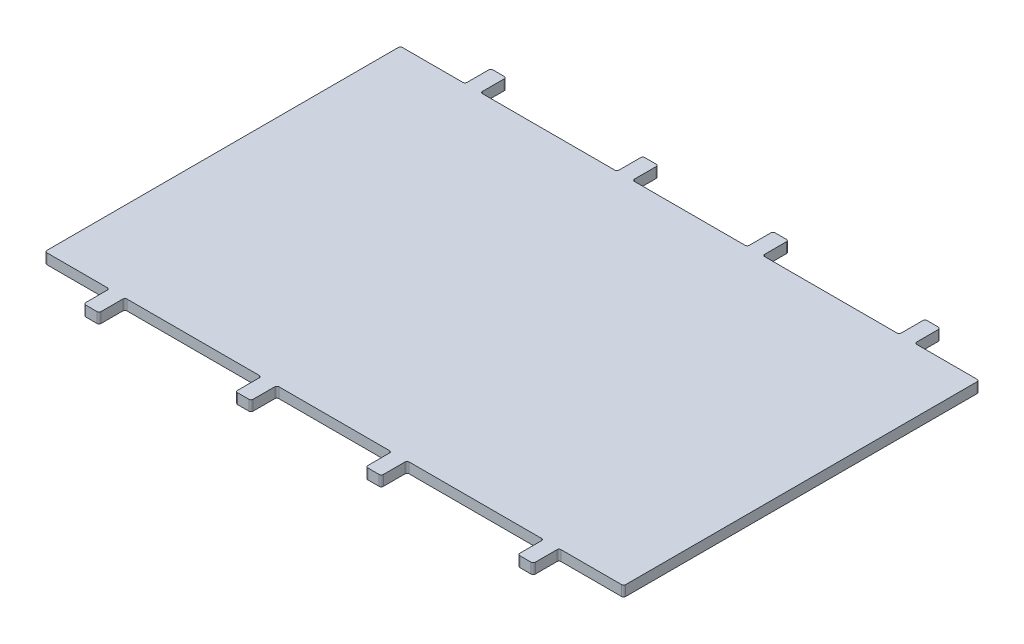
from build123d import *

# Parameters (mm, degrees)
SKETCH1_W               = 560
SKETCH1_H               = 344
BOSS_EXTRUDE1_DEPTH     = 10
SKETCH2_W               = 15
SKETCH2_H               = 25
BOSS_EXTRUDE2_DEPTH     = 10
MIRROR5_COPY_1_SKETCH_W = 15
MIRROR5_COPY_1_SKETCH_H = 25
MIRROR5_COPY_1_DEPTH    = 10
FILLET3_R               = 2


with BuildPart() as part:
    # Sketch1 → Boss-Extrude1 (new body)
    with BuildSketch(Plane(origin=(0, 0, 0), x_dir=(1, 0, 0), z_dir=(0, 1, 0))):
        Rectangle(SKETCH1_W, SKETCH1_H)
    extrude(amount=BOSS_EXTRUDE1_DEPTH)

    # Sketch2 → Boss-Extrude2 (add)
    with BuildSketch(Plane(origin=(0, 10, 0), x_dir=(1, 0, 0), z_dir=(0, 1, 0))):
        with Locations((-63, -184.5)):
            Rectangle(SKETCH2_W, SKETCH2_H)
        with Locations((-210, -184.5)):
            Rectangle(SKETCH2_W, SKETCH2_H)
    boss_extrude2 = extrude(amount=-BOSS_EXTRUDE2_DEPTH)

    # Mirror4: Boss-Extrude2 across plane
    add(boss_extrude2.mirror(Plane(origin=(0, 0, 0), x_dir=(0, 0, 1), z_dir=(1, 0, 0))))

    # Mirror5: Boss-Extrude2 across plane
    add(boss_extrude2.mirror(Plane.XY))

    # Mirror5 copy 1 sketch → Mirror5 copy 1 (add)
    with BuildSketch(Plane(origin=(0, 10, 0), x_dir=(-1, 0, 0), z_dir=(0, 1, 0))):
        with Locations((-63, -184.5)):
            Rectangle(MIRROR5_COPY_1_SKETCH_W, MIRROR5_COPY_1_SKETCH_H)
        with Locations((-210, -184.5)):
            Rectangle(MIRROR5_COPY_1_SKETCH_W, MIRROR5_COPY_1_SKETCH_H)
    extrude(amount=-MIRROR5_COPY_1_DEPTH)

    # Fillet3
    fillet3_edges = [part.edges().sort_by_distance(p)[0] for p in [
        (-70.5, 5, 197),
        (-70.5, 5, 172),
        (-55.5, 5, 172),
        (-55.5, 5, 197),
        (-202.5, 5, 172),
        (-202.5, 5, 197),
        (-217.5, 5, 197),
        (-217.5, 5, 172),
        (55.5, 5, 172),
        (55.5, 5, 197),
        (70.5, 5, 197),
        (70.5, 5, 172),
        (217.5, 5, 197),
        (217.5, 5, 172),
        (202.5, 5, 172),
        (202.5, 5, 197),
        (70.5, 5, -197),
        (70.5, 5, -172),
        (55.5, 5, -172),
        (55.5, 5, -197),
        (202.5, 5, -172),
        (202.5, 5, -197),
        (217.5, 5, -197),
        (217.5, 5, -172),
        (-280, 5, -172),
        (280, 5, -172),
        (280, 5, 172),
        (-280, 5, 172),
        (-55.5, 5, -172),
        (-55.5, 5, -197),
        (-70.5, 5, -197),
        (-70.5, 5, -172),
        (-217.5, 5, -197),
        (-217.5, 5, -172),
        (-202.5, 5, -172),
        (-202.5, 5, -197),
    ]]
    fillet(fillet3_edges, radius=FILLET3_R)


solid = part.part
